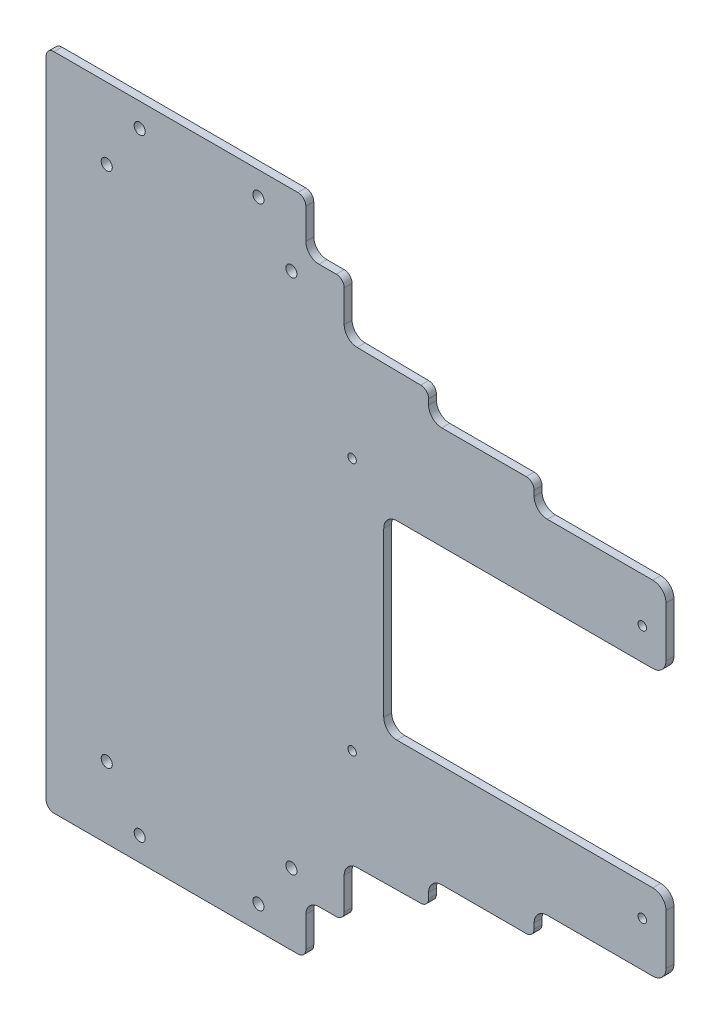
from build123d import *

# Parameters (mm, degrees)
SKETCH_1_W          = 235
SKETCH_1_H          = 250
EXTRUDE_1_DEPTH     = 3
SKETCH_2_W          = 107
SKETCH_2_H          = 72
CUT_EXTRUDE_1_DEPTH = 172.581613234
SKETCH_3_R          = 2.1
CUT_EXTRUDE_2_DEPTH = 10
SKETCH_4_R          = 1.6
CUT_EXTRUDE_3_DEPTH = 3
CUT_EXTRUDE_4_DEPTH = 172.581613234
SKETCH_6_R          = 2.1
CUT_EXTRUDE_5_DEPTH = 3
FILLET_1_R          = 5
FILLET_2_R          = 3


with BuildPart() as part:
    # 草图1 → 凸台-拉伸1 (new body)
    with BuildSketch(Plane.XY):
        Rectangle(SKETCH_1_W, SKETCH_1_H)
    extrude(amount=EXTRUDE_1_DEPTH)

    # 草图2 → 切除-拉伸1 (cut, through all)
    with BuildSketch(Plane.XY.offset(3)):
        with Locations((64, 0)):
            Rectangle(SKETCH_2_W, SKETCH_2_H)
    extrude(amount=-CUT_EXTRUDE_1_DEPTH, mode=Mode.SUBTRACT)

    # 草图3 → 切除-拉伸2 (cut)
    with BuildSketch(Plane.XY.offset(3)):
        with Locations((-94.5, 98)):
            Circle(SKETCH_3_R)
        with Locations((-24.5, 98)):
            Circle(SKETCH_3_R)
    cut_extrude_2 = extrude(amount=-CUT_EXTRUDE_2_DEPTH, mode=Mode.SUBTRACT)

    # 镜向1: 切除-拉伸2 across plane
    add(cut_extrude_2.mirror(Plane.ZX), mode=Mode.SUBTRACT)

    # 草图4 → 切除-拉伸3 (cut)
    with BuildSketch(Plane.XY.offset(3)):
        with Locations((108.5, 48)):
            Circle(SKETCH_4_R)
        with Locations((-1.5, 48)):
            Circle(SKETCH_4_R)
        with Locations((108.5, -48)):
            Circle(SKETCH_4_R)
        with Locations((-1.5, -48)):
            Circle(SKETCH_4_R)
    extrude(amount=-CUT_EXTRUDE_3_DEPTH, mode=Mode.SUBTRACT)

    # 草图5 → 切除-拉伸4 (cut, through all)
    with BuildSketch(Plane.XY.offset(3)):
        Polygon((117.5, 125), (27.5, 125), (-4.025914193, 125), (-19.025914193, 125), (-19.025914193, 105.446897357), (-4.496566438, 105.446897357), (-4.496879266, 85.446897359), (27.5, 85), (27.5, 75), (67.5, 75), (67.5, 65), (117.5, 65), align=None)
    cut_extrude_4 = extrude(amount=-CUT_EXTRUDE_4_DEPTH, mode=Mode.SUBTRACT)

    # 镜向2: 切除-拉伸4 across plane
    add(cut_extrude_4.mirror(Plane.ZX), mode=Mode.SUBTRACT)

    # 草图6 → 切除-拉伸5 (cut)
    with BuildSketch(Plane.XY.offset(3)):
        with Locations((-82, -116)):
            Circle(SKETCH_6_R)
        with Locations((-37, -116)):
            Circle(SKETCH_6_R)
    cut_extrude_5 = extrude(amount=-CUT_EXTRUDE_5_DEPTH, mode=Mode.SUBTRACT)

    # 镜向3: 切除-拉伸5 across plane
    add(cut_extrude_5.mirror(Plane.ZX), mode=Mode.SUBTRACT)

    # 圆角1
    fillet_1_edges = [part.edges().sort_by_distance(p)[0] for p in [
        (117.5, -65, 1.5),
        (-19.025914193, -105.446897357, 1.5),
        (-4.496879266, -85.446897359, 1.5),
        (27.5, -75, 1.5),
        (67.5, -65, 1.5),
        (10.5, -36, 1.5),
        (10.5, 36, 1.5),
        (117.5, 36, 1.5),
        (117.5, -36, 1.5),
        (117.5, 65, 1.5),
        (67.5, 65, 1.5),
        (27.5, 75, 1.5),
        (-4.496879266, 85.446897359, 1.5),
        (-19.025914193, 105.446897357, 1.5),
    ]]
    fillet(fillet_1_edges, radius=FILLET_1_R)

    # 圆角2
    fillet_2_edges = [part.edges().sort_by_distance(p)[0] for p in [
        (-19.025914193, -125, 1.5),
        (-4.496566438, -105.446897357, 1.5),
        (27.5, -85, 1.5),
        (67.5, -75, 1.5),
        (-117.5, -125, 1.5),
        (-117.5, 125, 1.5),
        (67.5, 75, 1.5),
        (27.5, 85, 1.5),
        (-4.496566438, 105.446897357, 1.5),
        (-19.025914193, 125, 1.5),
    ]]
    fillet(fillet_2_edges, radius=FILLET_2_R)


solid = part.part
